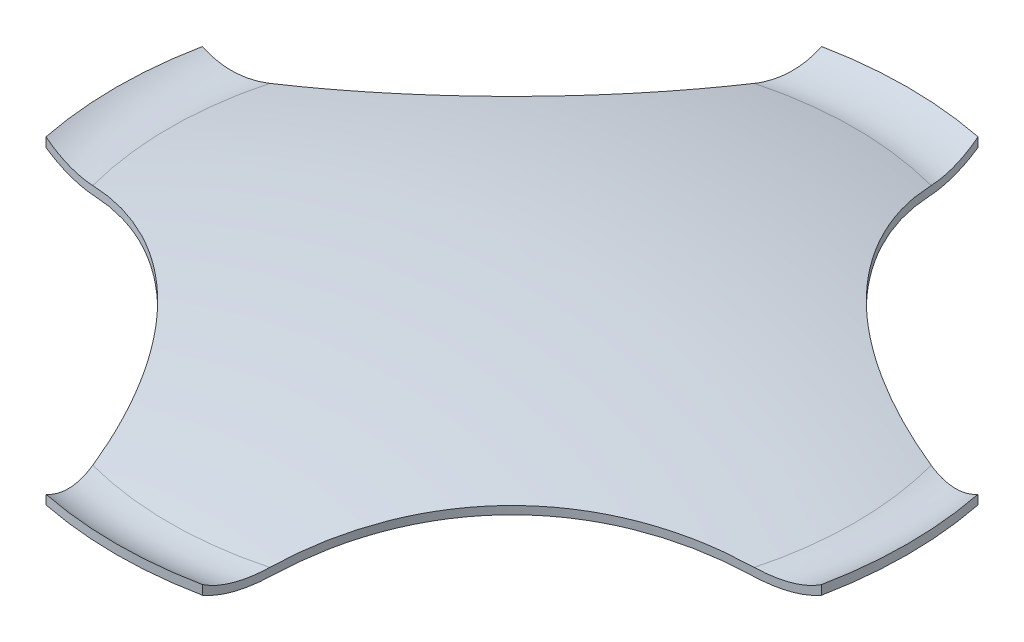
from build123d import *

# Parameters (mm, degrees)
CUT_EXTRUDE1_DEPTH = 5.263378942


with BuildPart() as part:
    # Sketch5 → Revolve1 (revolve)
    with BuildSketch(Plane.XY, mode=Mode.PRIVATE) as revolve1_sk:
        with BuildLine():
            Line((0, 0.36), (0, 0.42))
            ThreePointArc((0, 0.42), (1.309307341, 0.333915185), (2.596072387, 0.077142857))
            ThreePointArc((2.596072387, 0.077142857), (2.804955652, 0.066293195), (3, 0.141842092))
            Line((3, 0.141842092), (3, 0.071680396))
            ThreePointArc((3, 0.071680396), (2.795390742, 0.004331302), (2.580495952, 0.0192))
            ThreePointArc((2.580495952, 0.0192), (1.301451497, 0.274431693), (0, 0.36))
        make_face()
    revolve(revolve1_sk.sketch.rotate(Axis((0, -0.907364639, 0), (0, 1, 0)), 90), axis=Axis((0, -0.907364639, 0), (0, 1, 0)))

    # Sketch6 → Cut-Extrude1 (cut, through all)
    with BuildSketch(Plane(origin=(0, 0, 0), x_dir=(1, 0, 0), z_dir=(0, 1, 0))):
        with BuildLine():
            ThreePointArc((0.593193751, 2.940768807), (1.343502884, 1.343502884), (2.940768807, 0.593193751))
            ThreePointArc((2.940768807, 0.593193751), (2.121320344, 2.121320344), (0.593193751, 2.940768807))
        make_face()
        with BuildLine():
            ThreePointArc((2.940768807, -0.593193751), (1.343502884, -1.343502884), (0.593193751, -2.940768807))
            ThreePointArc((0.593193751, -2.940768807), (2.121320344, -2.121320344), (2.940768807, -0.593193751))
        make_face()
        with BuildLine():
            ThreePointArc((-0.593193751, -2.940768807), (-1.343502884, -1.343502884), (-2.940768807, -0.593193751))
            ThreePointArc((-2.940768807, -0.593193751), (-2.121320344, -2.121320344), (-0.593193751, -2.940768807))
        make_face()
        with BuildLine():
            ThreePointArc((-2.940768807, 0.593193751), (-1.343502884, 1.343502884), (-0.593193751, 2.940768807))
            ThreePointArc((-0.593193751, 2.940768807), (-2.121320344, 2.121320344), (-2.940768807, 0.593193751))
        make_face()
    extrude(amount=CUT_EXTRUDE1_DEPTH, mode=Mode.SUBTRACT)


solid = part.part
